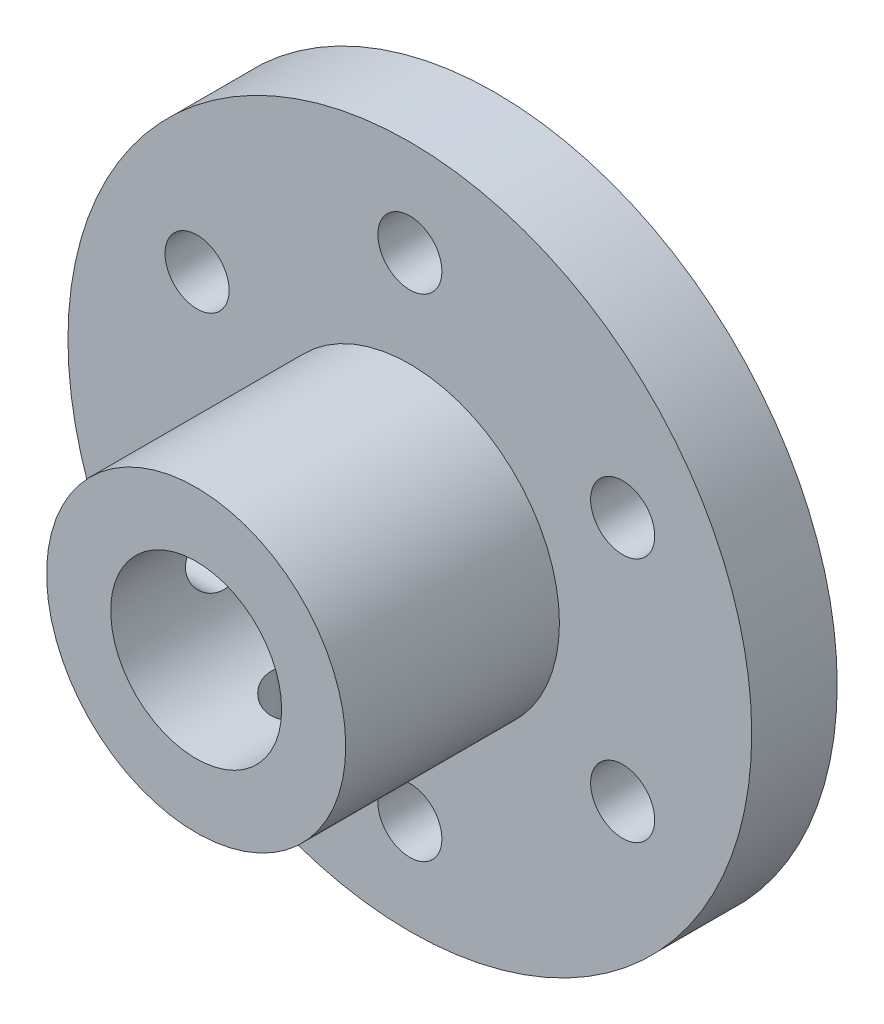
from build123d import *

# Parameters (mm, degrees)
SKETCH_1_R          = 16
SKETCH_1_R_2        = 4
SKETCH_1_R_3        = 1.5
EXTRUDE_1_DEPTH     = 4
SKETCH_2_R          = 7
SKETCH_2_R_2        = 4
EXTRUDE_2_DEPTH     = 10
SKETCH_3_R          = 1.5
CUT_EXTRUDE_1_DEPTH = 10
SKETCH_4_R          = 1.5
CUT_EXTRUDE_2_DEPTH = 10


with BuildPart() as part:
    # 草图1 → 凸台-拉伸1 (new body)
    with BuildSketch(Plane.XY):
        Circle(SKETCH_1_R)
        Circle(SKETCH_1_R_2, mode=Mode.SUBTRACT)
        with Locations((0, -11.5)):
            Circle(SKETCH_1_R_3, mode=Mode.SUBTRACT)
        with Locations((-9.959292144, -5.75)):
            Circle(SKETCH_1_R_3, mode=Mode.SUBTRACT)
        with Locations((-9.959292144, 5.75)):
            Circle(SKETCH_1_R_3, mode=Mode.SUBTRACT)
        with Locations((0, 11.5)):
            Circle(SKETCH_1_R_3, mode=Mode.SUBTRACT)
        with Locations((9.959292144, 5.75)):
            Circle(SKETCH_1_R_3, mode=Mode.SUBTRACT)
        with Locations((9.959292144, -5.75)):
            Circle(SKETCH_1_R_3, mode=Mode.SUBTRACT)
    extrude(amount=EXTRUDE_1_DEPTH)

    # 草图2 → 凸台-拉伸2 (add)
    with BuildSketch(Plane.XY.offset(4)):
        Circle(SKETCH_2_R)
        Circle(SKETCH_2_R_2, mode=Mode.SUBTRACT)
    extrude(amount=EXTRUDE_2_DEPTH)

    # 草图3 → 切除-拉伸1 (cut)
    with BuildSketch(Plane(origin=(0, 0, 0), x_dir=(1, 0, 0), z_dir=(0, 1, 0))):
        with Locations(Location((0, -9, 0), (0, 0, 270))):
            Circle(SKETCH_3_R)
    extrude(amount=-CUT_EXTRUDE_1_DEPTH, mode=Mode.SUBTRACT)

    # 草图4 → 切除-拉伸2 (cut)
    with BuildSketch(Plane(origin=(0, 0, 0), x_dir=(0, 0, -1), z_dir=(1, 0, 0))):
        with Locations(Location((-9, 0, 0), (0, 0, 180))):
            Circle(SKETCH_4_R)
    extrude(amount=-CUT_EXTRUDE_2_DEPTH, mode=Mode.SUBTRACT)


solid = part.part
